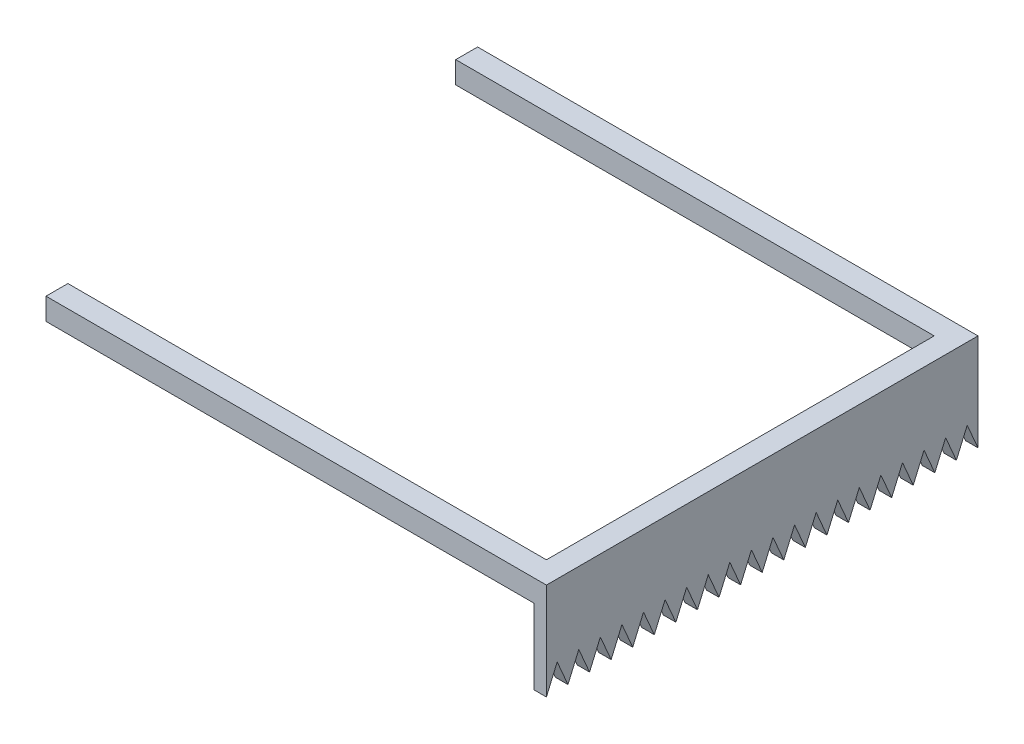
from build123d import *

# Parameters (mm, degrees)
SKETCH2_W           = 35
SKETCH2_H           = 35
BOSS_EXTRUDE1_DEPTH = 800
SKETCH3_W           = 35
SKETCH3_H           = 35
BOSS_EXTRUDE2_DEPTH = 620
SKETCH5_W           = 35
SKETCH5_H           = 35
BOSS_EXTRUDE3_DEPTH = 800
SKETCH6_W           = 20
SKETCH6_H           = 690
BOSS_EXTRUDE4_DEPTH = 120
CUT_EXTRUDE1_DEPTH  = 1064.249735481


with BuildPart() as part:
    # Sketch2 → Boss-Extrude1 (new body)
    with BuildSketch(Plane(origin=(0, 0, 0), x_dir=(0, 0, -1), z_dir=(1, 0, 0))):
        with Locations((17.5, 17.5)):
            Rectangle(SKETCH2_W, SKETCH2_H)
    extrude(amount=BOSS_EXTRUDE1_DEPTH)

    # Sketch3 → Boss-Extrude2 (add)
    with BuildSketch(Plane(origin=(0, 0, -35), x_dir=(-1, 0, 0), z_dir=(0, 0, -1))):
        with Locations((-782.5, 17.5)):
            Rectangle(SKETCH3_W, SKETCH3_H)
    extrude(amount=BOSS_EXTRUDE2_DEPTH)

    # Sketch5 → Boss-Extrude3 (add)
    with BuildSketch(Plane(origin=(800, 0, 0), x_dir=(0, 0, -1), z_dir=(1, 0, 0))):
        with Locations((672.5, 17.5)):
            Rectangle(SKETCH5_W, SKETCH5_H)
    extrude(amount=-BOSS_EXTRUDE3_DEPTH)

    # Sketch6 → Boss-Extrude4 (add)
    with BuildSketch(Plane.XZ):
        with Locations((790, -345)):
            Rectangle(SKETCH6_W, SKETCH6_H)
    extrude(amount=BOSS_EXTRUDE4_DEPTH)

    # Sketch7 → Cut-Extrude1 (cut, through all)
    with BuildSketch(Plane(origin=(800, 0, 0), x_dir=(0, 0, -1), z_dir=(1, 0, 0))):
        Polygon((51.75, -80), (34.5, -120), (69, -120), align=None)
        Polygon((86.25, -80), (69, -120), (103.5, -120), align=None)
        Polygon((120.75, -80), (103.5, -120), (138, -120), align=None)
        Polygon((155.25, -80), (138, -120), (172.5, -120), align=None)
        Polygon((189.75, -80), (172.5, -120), (207, -120), align=None)
        Polygon((224.25, -80), (207, -120), (241.5, -120), align=None)
        Polygon((258.75, -80), (241.5, -120), (276, -120), align=None)
        Polygon((293.25, -80), (276, -120), (310.5, -120), align=None)
        Polygon((327.75, -80), (310.5, -120), (345, -120), align=None)
        Polygon((362.25, -80), (345, -120), (379.5, -120), align=None)
        Polygon((396.75, -80), (379.5, -120), (414, -120), align=None)
        Polygon((431.25, -80), (414, -120), (448.5, -120), align=None)
        Polygon((465.75, -80), (448.5, -120), (483, -120), align=None)
        Polygon((500.25, -80), (483, -120), (517.5, -120), align=None)
        Polygon((534.75, -80), (517.5, -120), (552, -120), align=None)
        Polygon((569.25, -80), (552, -120), (586.5, -120), align=None)
        Polygon((603.75, -80), (586.5, -120), (621, -120), align=None)
        Polygon((638.25, -80), (621, -120), (655.5, -120), align=None)
        Polygon((672.75, -80), (655.5, -120), (690, -120), align=None)
        Polygon((17.25, -80), (34.5, -120), (0, -120), align=None)
    extrude(amount=-CUT_EXTRUDE1_DEPTH, mode=Mode.SUBTRACT)


solid = part.part
